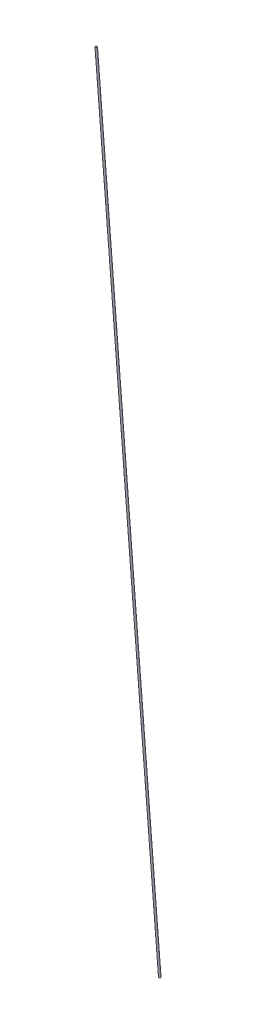
from build123d import *

# Parameters (mm, degrees)
SKETCH2_R = 2


with BuildPart() as part:
    # Sweep2: sweep along a path in Sketch1
    with BuildLine(Plane.XY) as sweep2_path:
        Line((0, 0), (141, -1718))
    # Sketch2 → Sweep2 (sweep)
    with BuildSketch(Plane(origin=(0, 0, 0), x_dir=(1, 0, 0), z_dir=(0, 1, 0))):
        Circle(SKETCH2_R)
    sweep(path=sweep2_path.line)


solid = part.part
